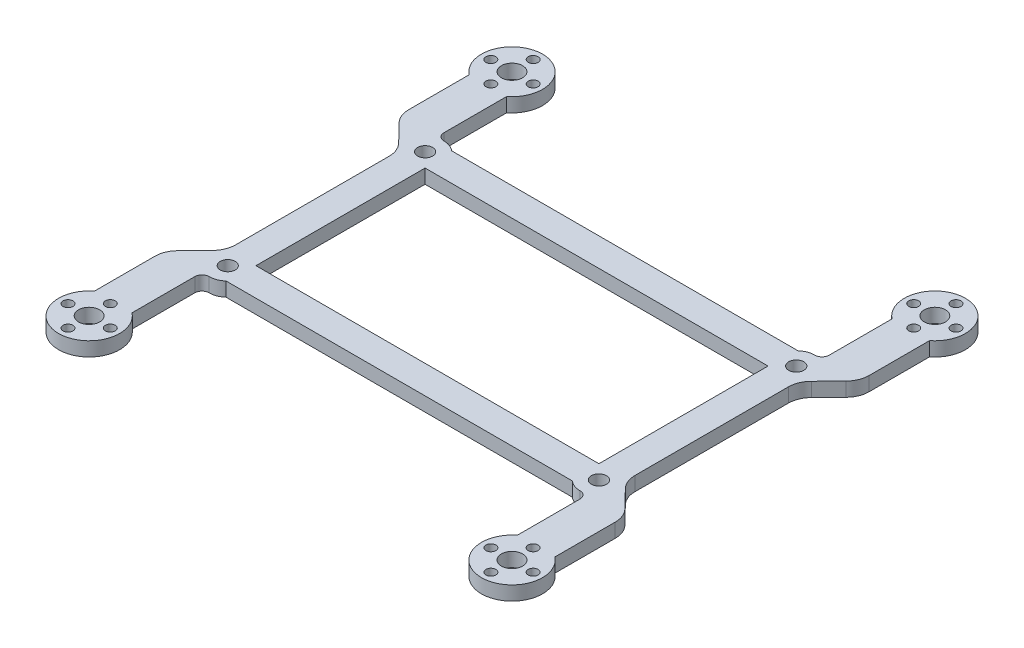
from build123d import *

# Parameters (mm, degrees)
SKETCH_1_R      = 1.6
SKETCH_1_R_2    = 2.25
SKETCH_1_R_3    = 1.05
SKETCH_1_W      = 73
SKETCH_1_H      = 36
EXTRUDE_2_DEPTH = 3


with BuildPart() as part:
    # 草图1 → 凸台-拉伸2 (new body)
    with BuildSketch(Plane(origin=(0, 0, 0), x_dir=(1, 0, 0), z_dir=(0, 1, 0))):
        with BuildLine():
            Line((41, 39.876524617), (41, 26.5))
            ThreePointArc((41, 26.5), (40.560660172, 25.439339828), (39.5, 25))
            ThreePointArc((39.5, 25), (38.085786438, 24.741657387), (36.854248689, 24))
            Line((36.854248689, 24), (-36.854248689, 24))
            ThreePointArc((-36.854248689, 24), (-38.085786438, 24.741657387), (-39.5, 25))
            ThreePointArc((-39.5, 25), (-40.560660172, 25.439339828), (-41, 26.5))
            Line((-41, 26.5), (-41, 39.876524617))
            ThreePointArc((-41, 39.876524617), (-45, 51.5), (-49, 39.876524617))
            Line((-49, 39.876524617), (-49, 27.037037037))
            ThreePointArc((-49, 27.037037037), (-48.630461799, 25.1505526), (-47.576470588, 23.54291939))
            Line((-47.576470588, 23.54291939), (-43.923529412, 19.803881957))
            ThreePointArc((-43.923529412, 19.803881957), (-42.869538201, 18.196248746), (-42.5, 16.30976431))
            Line((-42.5, 16.30976431), (-42.5, -16.30976431))
            ThreePointArc((-42.5, -16.30976431), (-42.869538201, -18.196248746), (-43.923529412, -19.803881957))
            Line((-43.923529412, -19.803881957), (-47.576470588, -23.54291939))
            ThreePointArc((-47.576470588, -23.54291939), (-48.630461799, -25.1505526), (-49, -27.037037037))
            Line((-49, -27.037037037), (-49, -39.876524617))
            ThreePointArc((-49, -39.876524617), (-45, -51.5), (-41, -39.876524617))
            Line((-41, -39.876524617), (-41, -26.5))
            ThreePointArc((-41, -26.5), (-40.560660172, -25.439339828), (-39.5, -25))
            ThreePointArc((-39.5, -25), (-38.085786438, -24.741657387), (-36.854248689, -24))
            Line((-36.854248689, -24), (36.854248689, -24))
            ThreePointArc((36.854248689, -24), (38.085786438, -24.741657387), (39.5, -25))
            ThreePointArc((39.5, -25), (40.560660172, -25.439339828), (41, -26.5))
            Line((41, -26.5), (41, -39.876524617))
            ThreePointArc((41, -39.876524617), (45, -51.5), (49, -39.876524617))
            Line((49, -39.876524617), (49, -27.037037037))
            ThreePointArc((49, -27.037037037), (48.630461799, -25.1505526), (47.576470588, -23.54291939))
            Line((47.576470588, -23.54291939), (43.923529412, -19.803881957))
            ThreePointArc((43.923529412, -19.803881957), (42.869538201, -18.196248746), (42.5, -16.30976431))
            Line((42.5, -16.30976431), (42.5, 16.30976431))
            ThreePointArc((42.5, 16.30976431), (42.869538201, 18.196248746), (43.923529412, 19.803881957))
            Line((43.923529412, 19.803881957), (47.576470588, 23.54291939))
            ThreePointArc((47.576470588, 23.54291939), (48.630461799, 25.1505526), (49, 27.037037037))
            Line((49, 27.037037037), (49, 39.876524617))
            ThreePointArc((49, 39.876524617), (45, 51.5), (41, 39.876524617))
        make_face()
        with Locations(Location((-39.5, 21, 0), (0, 0, 270))):
            Circle(SKETCH_1_R, mode=Mode.SUBTRACT)
        with Locations(Location((39.5, 21, 0), (0, 0, 270))):
            Circle(SKETCH_1_R, mode=Mode.SUBTRACT)
        with Locations(Location((39.5, -21, 0), (0, 0, 270))):
            Circle(SKETCH_1_R, mode=Mode.SUBTRACT)
        with Locations(Location((-39.5, -21, 0), (0, 0, 270))):
            Circle(SKETCH_1_R, mode=Mode.SUBTRACT)
        with Locations(Location((45, 45, 0), (0, 0, 270))):
            Circle(SKETCH_1_R_2, mode=Mode.SUBTRACT)
        with Locations(Location((45, 49.5, 0), (0, 0, 270))):
            Circle(SKETCH_1_R_3, mode=Mode.SUBTRACT)
        with Locations(Location((49.5, 45, 0), (0, 0, 270))):
            Circle(SKETCH_1_R_3, mode=Mode.SUBTRACT)
        with Locations(Location((45, 40.5, 0), (0, 0, 270))):
            Circle(SKETCH_1_R_3, mode=Mode.SUBTRACT)
        with Locations(Location((40.5, 45, 0), (0, 0, 270))):
            Circle(SKETCH_1_R_3, mode=Mode.SUBTRACT)
        with Locations(Location((40.5, -45, 0), (0, 0, 270))):
            Circle(SKETCH_1_R_3, mode=Mode.SUBTRACT)
        with Locations(Location((45, -40.5, 0), (0, 0, 270))):
            Circle(SKETCH_1_R_3, mode=Mode.SUBTRACT)
        with Locations(Location((49.5, -45, 0), (0, 0, 270))):
            Circle(SKETCH_1_R_3, mode=Mode.SUBTRACT)
        with Locations(Location((45, -49.5, 0), (0, 0, 270))):
            Circle(SKETCH_1_R_3, mode=Mode.SUBTRACT)
        with Locations(Location((45, -45, 0), (0, 0, 270))):
            Circle(SKETCH_1_R_2, mode=Mode.SUBTRACT)
        with Locations(Location((-45, -40.5, 0), (0, 0, 270))):
            Circle(SKETCH_1_R_3, mode=Mode.SUBTRACT)
        with Locations(Location((-40.5, -45, 0), (0, 0, 270))):
            Circle(SKETCH_1_R_3, mode=Mode.SUBTRACT)
        with Locations(Location((-45, -49.5, 0), (0, 0, 270))):
            Circle(SKETCH_1_R_3, mode=Mode.SUBTRACT)
        with Locations(Location((-49.5, -45, 0), (0, 0, 270))):
            Circle(SKETCH_1_R_3, mode=Mode.SUBTRACT)
        with Locations(Location((-45, -45, 0), (0, 0, 270))):
            Circle(SKETCH_1_R_2, mode=Mode.SUBTRACT)
        with Locations(Location((-40.5, 45, 0), (0, 0, 270))):
            Circle(SKETCH_1_R_3, mode=Mode.SUBTRACT)
        with Locations(Location((-45, 40.5, 0), (0, 0, 270))):
            Circle(SKETCH_1_R_3, mode=Mode.SUBTRACT)
        with Locations(Location((-49.5, 45, 0), (0, 0, 270))):
            Circle(SKETCH_1_R_3, mode=Mode.SUBTRACT)
        with Locations(Location((-45, 49.5, 0), (0, 0, 270))):
            Circle(SKETCH_1_R_3, mode=Mode.SUBTRACT)
        with Locations(Location((-45, 45, 0), (0, 0, 270))):
            Circle(SKETCH_1_R_2, mode=Mode.SUBTRACT)
        Rectangle(SKETCH_1_W, SKETCH_1_H, mode=Mode.SUBTRACT)
    extrude(amount=EXTRUDE_2_DEPTH)


solid = part.part
